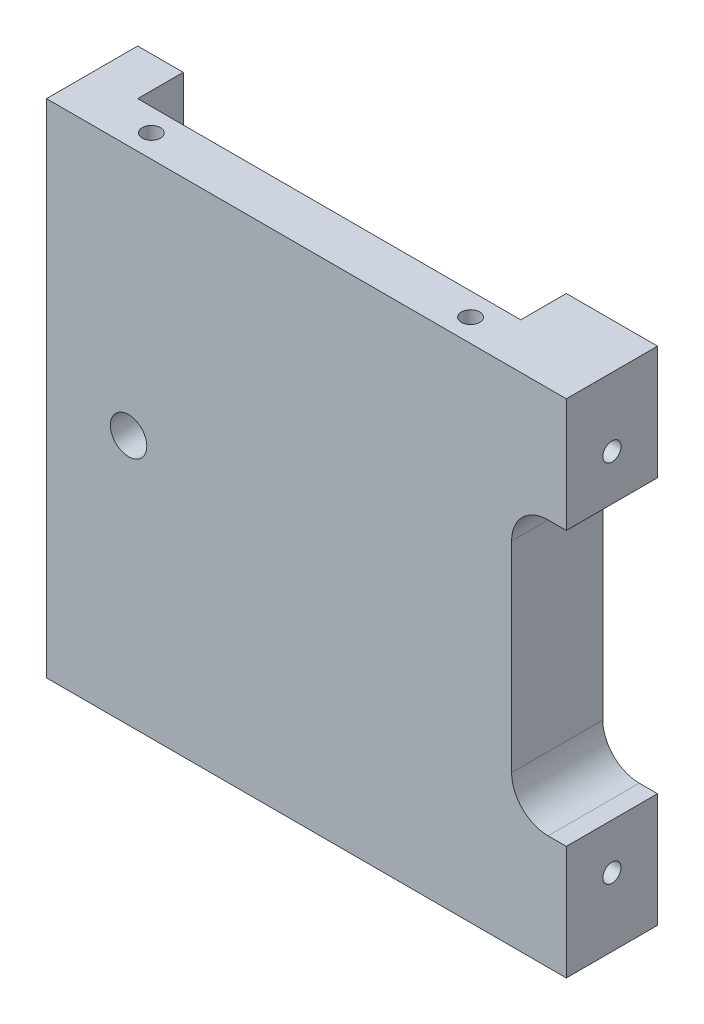
from build123d import *

# Parameters (mm, degrees)
ESQUISSE1_W                    = 85
ESQUISSE1_H                    = 55
BOSS_EXTRU_1_DEPTH             = 10
ESQUISSE2_W                    = 8
ESQUISSE2_H                    = 5
ESQUISSE2_W_2                  = 42
ENL_V_MAT_EXTRU_1_DEPTH        = 102.734949747
ESQUISSE3_R                    = 2
ENL_V_MAT_EXTRU_2_DEPTH        = 90.895772982
TROU_TARAUD_M3X0_51_AT_2_COUNT = 2
TROU_TARAUD_M3X0_51_AT_2_PITCH = 33
TROU_TARAUD_M3X0_51_AT_3_COUNT = 2
TROU_TARAUD_M3X0_51_AT_3_PITCH = 68
TROU_TARAUD_M3X0_52_D          = 2
TROU_TARAUD_M3X0_52_DEPTH      = 12
TROU_TARAUD_M3X0_52_TIP        = 0.600860619
ESQUISSE8_W                    = 28
ESQUISSE8_H                    = 10
ENL_V_MAT_EXTRU_3_DEPTH        = 102.734949747
ESQUISSE9_W                    = 6
ESQUISSE9_H                    = 30
ENL_V_MAT_EXTRU_4_DEPTH        = 90.895772982
CONG_1_R                       = 4


with BuildPart() as part:
    # Esquisse1 → Boss.-Extru.1 (new body)
    with BuildSketch(Plane.XY):
        with Locations((42.5, 0)):
            Rectangle(ESQUISSE1_W, ESQUISSE1_H)
    extrude(amount=BOSS_EXTRU_1_DEPTH)

    # Esquisse2 → Enlèv. mat.-Extru.1 (cut, through all)
    with BuildSketch(Plane(origin=(0, 27.5, 0), x_dir=(1, 0, 0), z_dir=(0, 1, 0))):
        with Locations((4, -2.5)):
            Rectangle(ESQUISSE2_W, ESQUISSE2_H)
        with Locations((54, -2.5)):
            Rectangle(ESQUISSE2_W_2, ESQUISSE2_H)
    extrude(amount=-ENL_V_MAT_EXTRU_1_DEPTH, mode=Mode.SUBTRACT)

    # Esquisse3 → Enlèv. mat.-Extru.2 (cut, through all)
    with BuildSketch(Plane.XY.offset(10)):
        with Locations((4, 0)):
            Circle(ESQUISSE3_R)
        with Locations((37, 0)):
            Circle(ESQUISSE3_R)
    extrude(amount=-ENL_V_MAT_EXTRU_2_DEPTH, mode=Mode.SUBTRACT)

    # Esquisse4 → Trou taraudé M3x0.51 (revolve, cut)
    with BuildSketch(Plane(origin=(4, -27.5, 7.5), x_dir=(0, 0, -1), z_dir=(1, 0, 0))):
        Polygon((0, 0), (0, 15.600860619), (1, 15), (1, 0), align=None)
    trou_taraud_m3x0_51 = revolve(axis=Axis((4, -33.85, 7.5), (0, 1, 0)), mode=Mode.SUBTRACT)

    # Trou taraudé M3x0.51 at 2: Trou taraudé M3x0.51 ×2
    with Locations(*[(i * TROU_TARAUD_M3X0_51_AT_2_PITCH, 0, 0) for i in range(1, TROU_TARAUD_M3X0_51_AT_2_COUNT)]):
        add(trou_taraud_m3x0_51, mode=Mode.SUBTRACT)

    # Trou taraudé M3x0.51 at 3: Trou taraudé M3x0.51 ×2
    with Locations(*[(i * TROU_TARAUD_M3X0_51_AT_3_PITCH, 0, 0) for i in range(1, TROU_TARAUD_M3X0_51_AT_3_COUNT)]):
        add(trou_taraud_m3x0_51, mode=Mode.SUBTRACT)

    # Symétrie1: Trou taraudé M3x0.51 across plane
    add(trou_taraud_m3x0_51.mirror(Plane.ZX), mode=Mode.SUBTRACT)

    # Symétrie1 copy 1 sketch → Symétrie1 copy 1 (revolve, cut)
    with BuildSketch(Plane(origin=(37, 27.5, 7.5), x_dir=(0, 0, -1), z_dir=(1, 0, 0))):
        Polygon((0, 0), (0, -15.600860619), (1, -15), (1, 0), align=None)
    revolve(axis=Axis((37, 33.85, 7.5), (0, 1, 0)), mode=Mode.SUBTRACT)

    # Symétrie1 copy 2 sketch → Symétrie1 copy 2 (revolve, cut)
    with BuildSketch(Plane(origin=(72, 27.5, 7.5), x_dir=(0, 0, -1), z_dir=(1, 0, 0))):
        Polygon((0, 0), (0, -15.600860619), (1, -15), (1, 0), align=None)
    revolve(axis=Axis((72, 33.85, 7.5), (0, 1, 0)), mode=Mode.SUBTRACT)

    # Trou taraudé M3x0.52
    with Locations(Plane(origin=(85, 0, 0), x_dir=(0, 0, -1), z_dir=(1, 0, 0))):
        with Locations((-5, 20), (-5, -20)):
            Hole(TROU_TARAUD_M3X0_52_D / 2, depth=TROU_TARAUD_M3X0_52_DEPTH)
            with Locations((0, 0, -(TROU_TARAUD_M3X0_52_DEPTH + TROU_TARAUD_M3X0_52_TIP / 2))):  # 118° drill point
                Cone(0, TROU_TARAUD_M3X0_52_D / 2, TROU_TARAUD_M3X0_52_TIP, mode=Mode.SUBTRACT)

    # Esquisse8 → Enlèv. mat.-Extru.3 (cut, through all)
    with BuildSketch(Plane.XZ.offset(27.5)):
        with Locations((14, 5)):
            Rectangle(ESQUISSE8_W, ESQUISSE8_H)
    extrude(amount=-ENL_V_MAT_EXTRU_3_DEPTH, mode=Mode.SUBTRACT)

    # Esquisse9 → Enlèv. mat.-Extru.4 (cut, through all)
    with BuildSketch(Plane.XY.offset(10)):
        with Locations((82, 0)):
            Rectangle(ESQUISSE9_W, ESQUISSE9_H)
    extrude(amount=-ENL_V_MAT_EXTRU_4_DEPTH, mode=Mode.SUBTRACT)

    # Congé1
    cong_1_edges = [part.edges().sort_by_distance(p)[0] for p in [
        (79, -15, 5),
        (79, 15, 5),
    ]]
    fillet(cong_1_edges, radius=CONG_1_R)


solid = part.part
